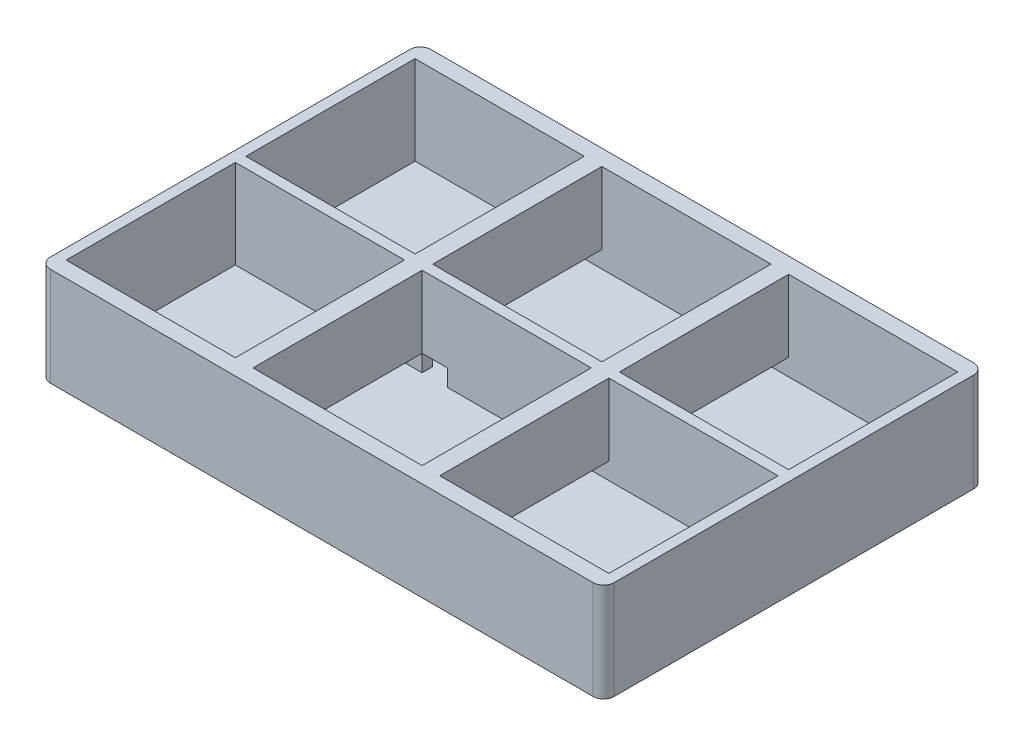
from build123d import *

# Parameters (mm, degrees)
SKETCH1_W           = 400
SKETCH1_H           = 270
BOSS_EXTRUDE1_DEPTH = 70
FILLET1_R           = 7.5
SKETCH3_W           = 120
SKETCH3_H           = 120
CUT_EXTRUDE1_DEPTH  = 63
SKETCH5_W           = 120
SKETCH5_H           = 12
CUT_EXTRUDE2_DEPTH  = 153
SKETCH6_W           = 120
SKETCH6_H           = 12
CUT_EXTRUDE3_DEPTH  = 153
CUT_EXTRUDE4_REACH  = 255.281
SKETCH7_W           = 18
SKETCH7_H           = 12


with BuildPart() as part:
    # Sketch1 → Boss-Extrude1 (new body)
    with BuildSketch(Plane(origin=(0, 0, 0), x_dir=(1, 0, 0), z_dir=(0, 1, 0))):
        Rectangle(SKETCH1_W, SKETCH1_H)
    extrude(amount=BOSS_EXTRUDE1_DEPTH)

    # Fillet1
    fillet1_edges = [part.edges().sort_by_distance(p)[0] for p in [
        (-200, 35, -135),
        (200, 35, -135),
        (200, 35, 135),
        (-200, 35, 135),
    ]]
    fillet(fillet1_edges, radius=FILLET1_R)

    # Sketch3 → Cut-Extrude1 (cut)
    with BuildSketch(Plane(origin=(0, 70, 0), x_dir=(1, 0, 0), z_dir=(0, 1, 0))):
        with Locations((0, 63.749469805)):
            Rectangle(SKETCH3_W, SKETCH3_H)
        with Locations((-132.500014476, 63.749478681)):
            Rectangle(SKETCH3_W, SKETCH3_H)
        with Locations((132.500029203, 63.749477903)):
            Rectangle(SKETCH3_W, SKETCH3_H)
        with Locations((132.500029203, -63.749477903)):
            Rectangle(SKETCH3_W, SKETCH3_H)
        with Locations((0, -63.749469805)):
            Rectangle(SKETCH3_W, SKETCH3_H)
        with Locations((-132.500014476, -63.749478681)):
            Rectangle(SKETCH3_W, SKETCH3_H)
    extrude(amount=-CUT_EXTRUDE1_DEPTH, mode=Mode.SUBTRACT)

    # Sketch5 → Cut-Extrude2 (cut)
    with BuildSketch(Plane.ZY.offset(72.500014476)):
        with Locations((-63.749478681, 13)):
            Rectangle(SKETCH5_W, SKETCH5_H)
    extrude(amount=-CUT_EXTRUDE2_DEPTH, mode=Mode.SUBTRACT)

    # Sketch6 → Cut-Extrude3 (cut)
    with BuildSketch(Plane.ZY.offset(72.500014476)):
        with Locations((63.749478681, 13)):
            Rectangle(SKETCH6_W, SKETCH6_H)
    extrude(amount=-CUT_EXTRUDE3_DEPTH, mode=Mode.SUBTRACT)

    # Sketch7 → Cut-Extrude4 (cut, up to next)
    with BuildSketch(Plane.XY.offset(3.749477903), mode=Mode.PRIVATE) as cut_extrude4_sk1:
        with Locations((-51, 13)):
            Rectangle(SKETCH7_W, SKETCH7_H)
    cut_extrude4_tool1 = extrude(cut_extrude4_sk1.sketch, amount=-CUT_EXTRUDE4_REACH, mode=Mode.PRIVATE) & part.part
    # Sketch7 → Cut-Extrude4 (cut, up to next)
    with BuildSketch(Plane.XY.offset(3.749477903), mode=Mode.PRIVATE) as cut_extrude4_sk2:
        with Locations((51, 13)):
            Rectangle(SKETCH7_W, SKETCH7_H)
    cut_extrude4_tool2 = extrude(cut_extrude4_sk2.sketch, amount=-CUT_EXTRUDE4_REACH, mode=Mode.PRIVATE) & part.part
    add(cut_extrude4_tool1.solids().sort_by_distance((-51, 13, 3.749478))[0], mode=Mode.SUBTRACT)
    add(cut_extrude4_tool2.solids().sort_by_distance((51, 13, 3.749478))[0], mode=Mode.SUBTRACT)


solid = part.part
